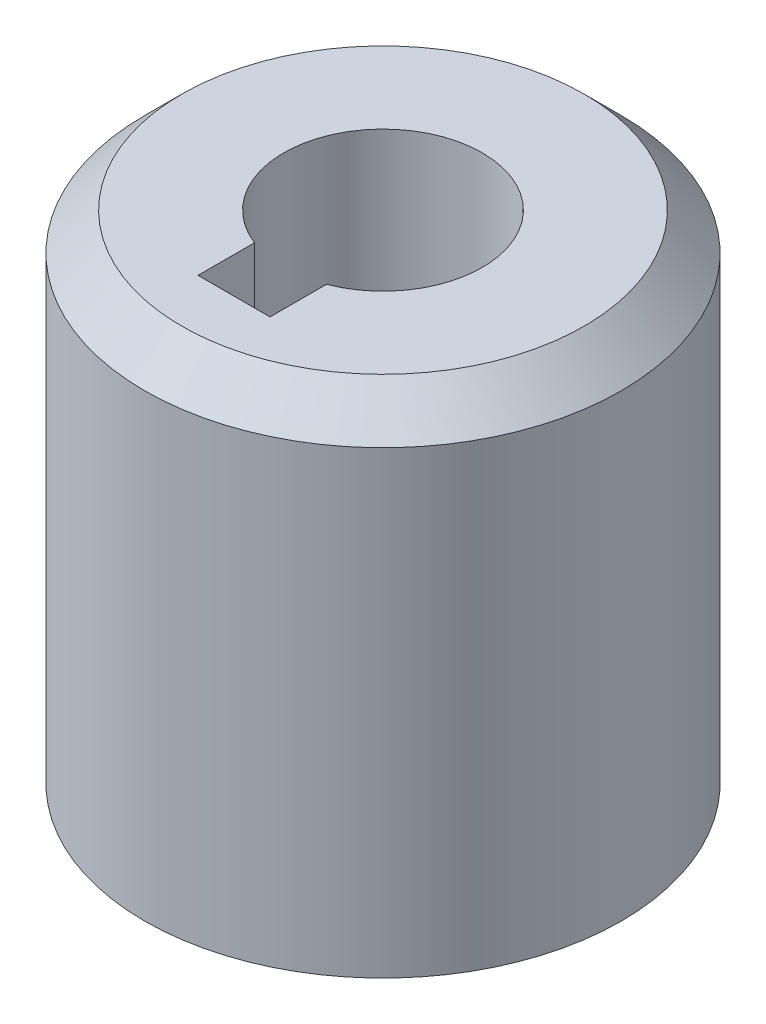
from build123d import *

# Parameters (mm, degrees)
SKETCH1_R           = 9.6
BOSS_EXTRUDE1_DEPTH = 20
CHAMFER1_SIZE       = 1.5


with BuildPart() as part:
    # Sketch1 → Boss-Extrude1 (new body)
    with BuildSketch(Plane(origin=(0, 0, 0), x_dir=(1, 0, 0), z_dir=(0, 1, 0))):
        with Locations(Location((0, 0, 0), (0, 0, 270))):
            Circle(SKETCH1_R)
        with BuildLine():
            Line((-1.45, -6), (1.45, -6))
            Line((1.45, -6), (1.45, -3.727935085))
            ThreePointArc((1.45, -3.727935085), (0, 4), (-1.45, -3.727935085))
            Line((-1.45, -3.727935085), (-1.45, -6))
        make_face(mode=Mode.SUBTRACT)
    extrude(amount=BOSS_EXTRUDE1_DEPTH)

    # Chamfer1
    chamfer1_edges = [part.edges().sort_by_distance(p)[0] for p in [
        (0, 20, -9.6),
    ]]
    chamfer(chamfer1_edges, length=CHAMFER1_SIZE)


solid = part.part
